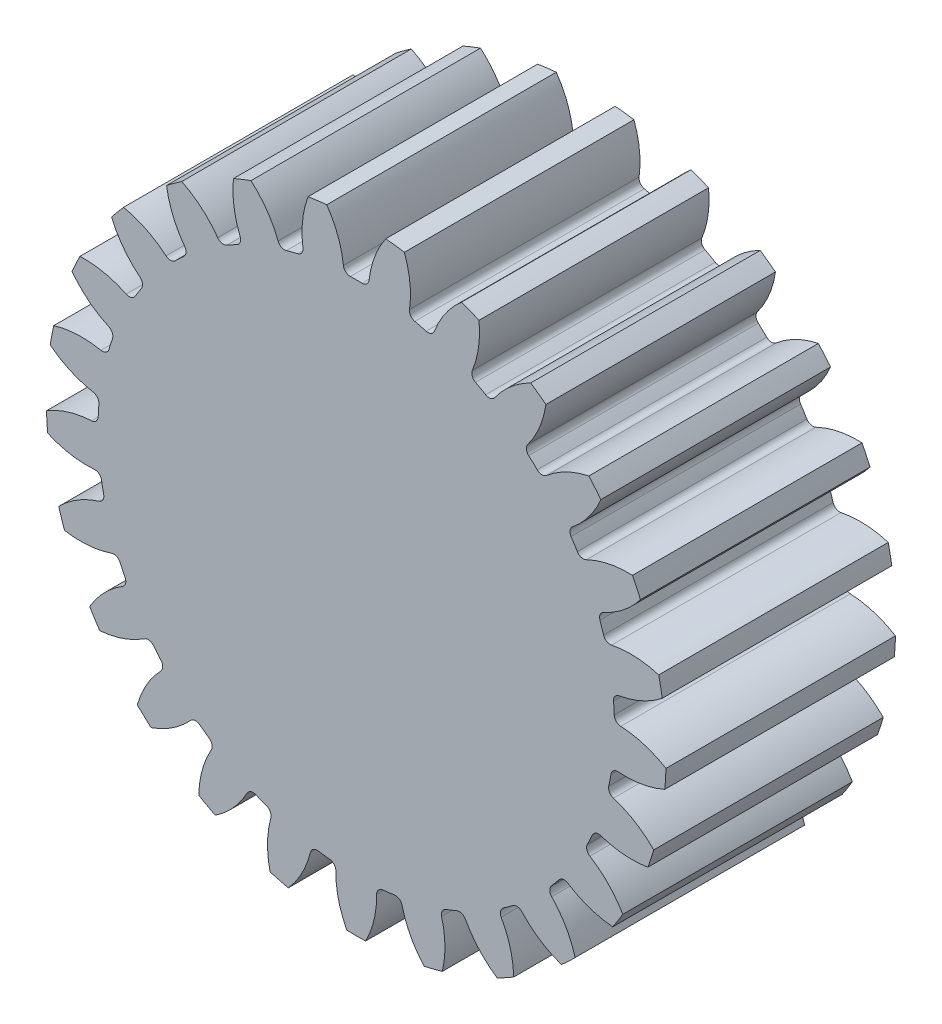
from build123d import *

# Parameters (mm, degrees)
SKETCH1_R                = 27
BOSS_EXTRUDE2_DEPTH      = 10
CUT_EXTRUDE1_DEPTH       = 40.471508712
FILLET1_R                = 0.6
CIRPATTERN1_COUNT        = 25
FILLET1_OF_CIRPATTERN1_R = 0.6


with BuildPart() as part:
    # Sketch1 → Boss-Extrude2 (new, symmetric)
    with BuildSketch(Plane.XY):
        with Locations(Location((0, 0, 0), (0, 0, 180))):
            Circle(SKETCH1_R)
    extrude(amount=BOSS_EXTRUDE2_DEPTH, both=True)

    # Sketch4 → Cut-Extrude1 (cut, symmetric)
    with BuildSketch(Plane.XY):
        with BuildLine():
            ThreePointArc((3.31531694, 27.803033532), (0, 28), (-3.31531694, 27.803033532))
            ThreePointArc((-3.31531694, 27.803033532), (-1.721489921, 25.337524375), (-1.072022538, 22.474446994))
            ThreePointArc((-1.072022538, 22.474446994), (0, 22.5), (1.072022538, 22.474446994))
            ThreePointArc((1.072022538, 22.474446994), (1.721489921, 25.337524375), (3.31531694, 27.803033532))
        make_face()
    cut_extrude1 = extrude(amount=CUT_EXTRUDE1_DEPTH, both=True, mode=Mode.SUBTRACT)

    # Fillet1
    fillet1_edges = [part.edges().sort_by_distance(p)[0] for p in [
        (-1.072022538, 22.474446994, 0),
        (1.072022538, 22.474446994, 0),
    ]]
    fillet(fillet1_edges, radius=FILLET1_R)

    # CirPattern1: Cut-Extrude1 ×25 about axis
    cirpattern1_axis = Axis((0, 0, 0), (0, 0, 1))
    for i in range(1, CIRPATTERN1_COUNT):
        add(cut_extrude1.rotate(cirpattern1_axis, i * 360 / CIRPATTERN1_COUNT), mode=Mode.SUBTRACT)

    # Fillet1 of CirPattern1
    fillet1_of_cirpattern1_edges = [part.edges().sort_by_distance(p)[0] for p in [
        (-6.627510666, 21.50176975, 0),
        (-4.550824708, 22.034972078, 0),
        (-11.766567924, 19.178057235, 0),
        (-9.887726902, 20.210958827, 0),
        (-16.166288445, 15.649316851, 0),
        (-14.603346849, 17.117016703, 0),
        (-19.550221608, 11.137272336, 0),
        (-18.401384806, 12.947549467, 0),
        (-21.705742446, 5.92543204, 0),
        (-21.043196081, 7.964540081, 0),
        (-22.497411659, 0.341275057, 0),
        (-22.362785954, 2.481089349, 0),
        (-21.875485757, -5.264325494, 0),
        (-22.277239742, -3.158257351, 0),
        (-19.879042632, -10.539149113, 0),
        (-20.791932626, -8.599159126, 0),
        (-16.63352615, -15.151759232, 0),
        (-18.000191916, -13.499744108, 0),
        (-12.342864045, -18.812328595, 0),
        (-14.077432948, -17.552090519, 0),
        (-7.276654398, -21.290850165, 0),
        (-9.270137095, -20.501574531, 0),
        (-1.753225794, -22.431589318, 0),
        (-3.880364434, -22.162869215, 0),
        (3.880364434, -22.162869215, 0),
        (1.753225794, -22.431589318, 0),
        (9.270137095, -20.501574531, 0),
        (7.276654398, -21.290850165, 0),
        (14.077432948, -17.552090519, 0),
        (12.342864045, -18.812328595, 0),
        (18.000191916, -13.499744108, 0),
        (16.63352615, -15.151759232, 0),
        (20.791932626, -8.599159126, 0),
        (19.879042632, -10.539149113, 0),
        (22.277239742, -3.158257351, 0),
        (21.875485757, -5.264325494, 0),
        (22.362785954, 2.481089349, 0),
        (22.497411659, 0.341275057, 0),
        (21.043196081, 7.964540081, 0),
        (21.705742446, 5.92543204, 0),
        (18.401384806, 12.947549467, 0),
        (19.550221608, 11.137272336, 0),
        (14.603346849, 17.117016703, 0),
        (16.166288445, 15.649316851, 0),
        (9.887726902, 20.210958827, 0),
        (11.766567924, 19.178057235, 0),
        (4.550824708, 22.034972078, 0),
        (6.627510666, 21.50176975, 0),
    ]]
    fillet(fillet1_of_cirpattern1_edges, radius=FILLET1_OF_CIRPATTERN1_R)


solid = part.part
